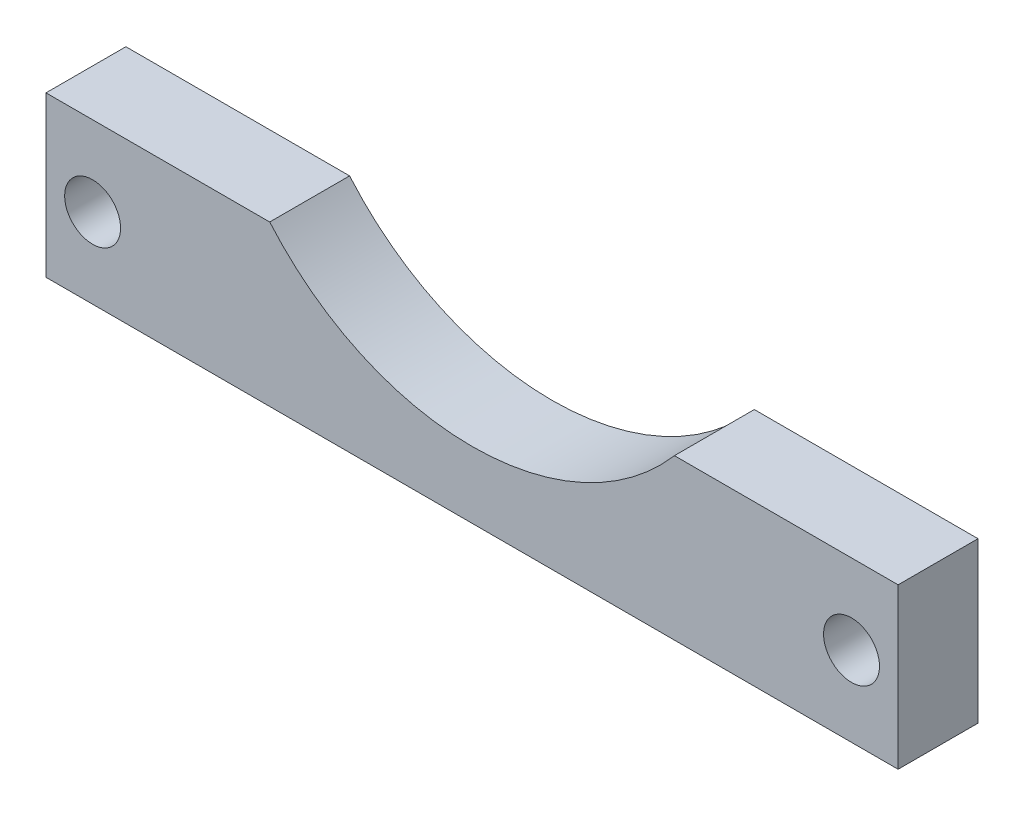
from build123d import *

# Parameters (mm, degrees)
ESQUISSE1_W             = 32
ESQUISSE1_H             = 6
BOSS_EXTRU_1_DEPTH      = 3
ESQUISSE1_3_R           = 1.05
ENL_V_MAT_EXTRU_1_DEPTH = 19


with BuildPart() as part:
    # Esquisse1 → Boss.-Extru.1 (new body)
    with BuildSketch(Plane.XY):
        with Locations((-7.60481861, 2.703893443)):
            Rectangle(ESQUISSE1_W, ESQUISSE1_H)
    extrude(amount=BOSS_EXTRU_1_DEPTH)

    # Esquisse1<3> → Enlèv. mat.-Extru.1 (cut)
    with BuildSketch(Plane.XY):
        with BuildLine():
            Line((-0.005476534, 5.703893443), (-15.204160687, 5.703893443))
            ThreePointArc((-15.204160687, 5.703893443), (-7.60481861, 2.203893443), (-0.005476534, 5.703893443))
        make_face()
        with Locations((6.64518139, 2.703893443)):
            Circle(ESQUISSE1_3_R)
        with Locations((-21.85481861, 2.703893443)):
            Circle(ESQUISSE1_3_R)
    extrude(amount=ENL_V_MAT_EXTRU_1_DEPTH, mode=Mode.SUBTRACT)


solid = part.part
